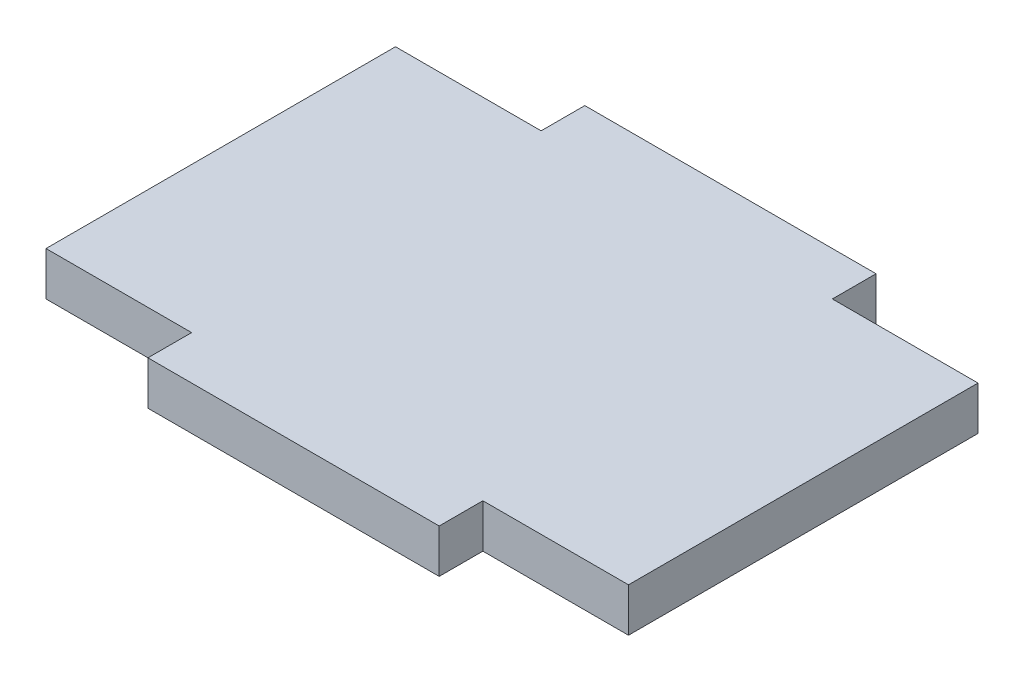
from build123d import *

# Parameters (mm, degrees)
BOSS_EXTRUDE1_DEPTH = 3


with BuildPart() as part:
    # Sketch1 → Boss-Extrude1 (new body)
    with BuildSketch(Plane(origin=(0, 0, 0), x_dir=(1, 0, 0), z_dir=(0, 1, 0))):
        Polygon((-10, 15), (10, 15), (10, 12), (20, 12), (20, -12), (10, -12), (10, -15), (-10, -15), (-10, -12), (-20, -12), (-20, 12), (-10, 12), align=None)
    extrude(amount=BOSS_EXTRUDE1_DEPTH)


solid = part.part
